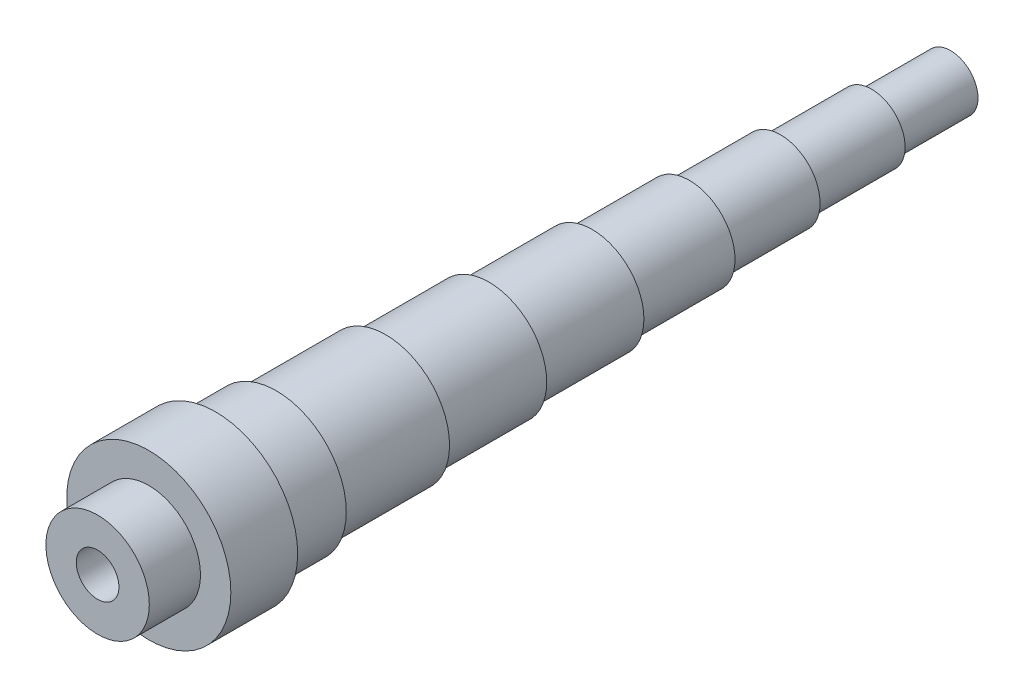
from build123d import *


with BuildPart() as part:
    # Sketch1 → Revolve1 (revolve)
    with BuildSketch(Plane(origin=(0, 0, 0), x_dir=(0, 0, -1), z_dir=(1, 0, 0)), mode=Mode.PRIVATE) as revolve1_sk:
        Polygon((-264.03808, 12.7), (213.40064, 12.7), (213.40064, 16.31696), (166.38016, 16.31696), (166.38016, 19.93392), (112.12576, 19.93392), (112.12576, 23.55088), (57.87136, 23.55088), (57.87136, 27.16784), (0, 27.16784), (0, 30.7848), (-61.48832, 30.7848), (-61.48832, 34.40176), (-122.97664, 34.40176), (-122.97664, 38.01872), (-188.08192, 38.01872), (-188.08192, 41.63568), (-224.25152, 41.63568), (-224.25152, 48.8696), (-264.03808, 48.8696), (-264.03808, 38.01872), (-264.03808, 30.7848), (-294.51808, 30.7848), (-294.51808, 12.7), align=None)
    revolve(revolve1_sk.sketch.rotate(Axis((0, 0, 19.904928919), (0, 0, -1)), 90), axis=Axis((0, 0, 19.904928919), (0, 0, -1)))


solid = part.part
